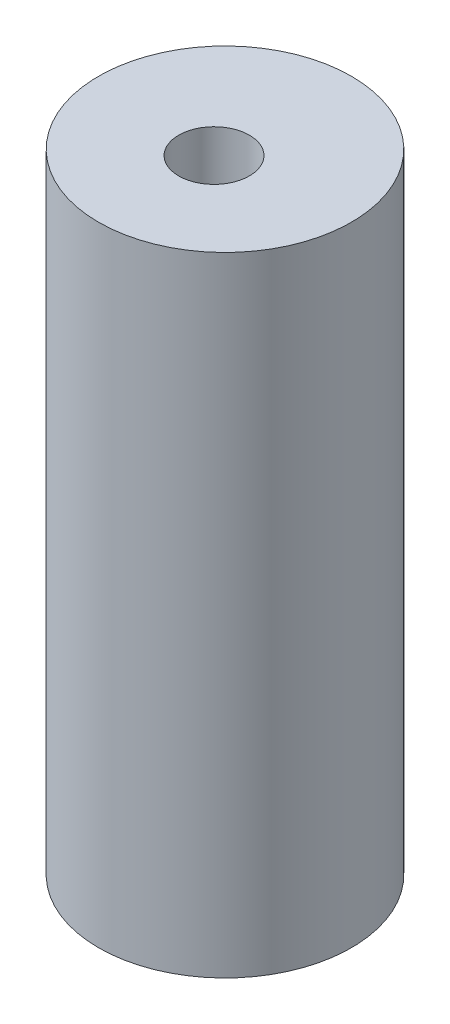
from build123d import *

# Parameters (mm, degrees)
SKIZZE1_R                       = 8.05
AUFSATZ_LINEAR_AUSTRAGEN1_DEPTH = 40
DURCHGANGSLOCH_F_R_M41_D        = 4.5


with BuildPart() as part:
    # Skizze1 → Aufsatz-Linear austragen1 (new body)
    with BuildSketch(Plane(origin=(0, 0, 0), x_dir=(1, 0, 0), z_dir=(0, 1, 0))):
        with Locations(Location((0, 0, 0), (0, 0, 270))):
            Circle(SKIZZE1_R)
    extrude(amount=AUFSATZ_LINEAR_AUSTRAGEN1_DEPTH)

    # Durchgangsloch für M41 (through all)
    with Locations(Plane(origin=(0, 40, 0), x_dir=(1, 0, 0), z_dir=(0, 1, 0))):
        with Locations((0, -0.698463559)):
            Hole(DURCHGANGSLOCH_F_R_M41_D / 2)


solid = part.part
